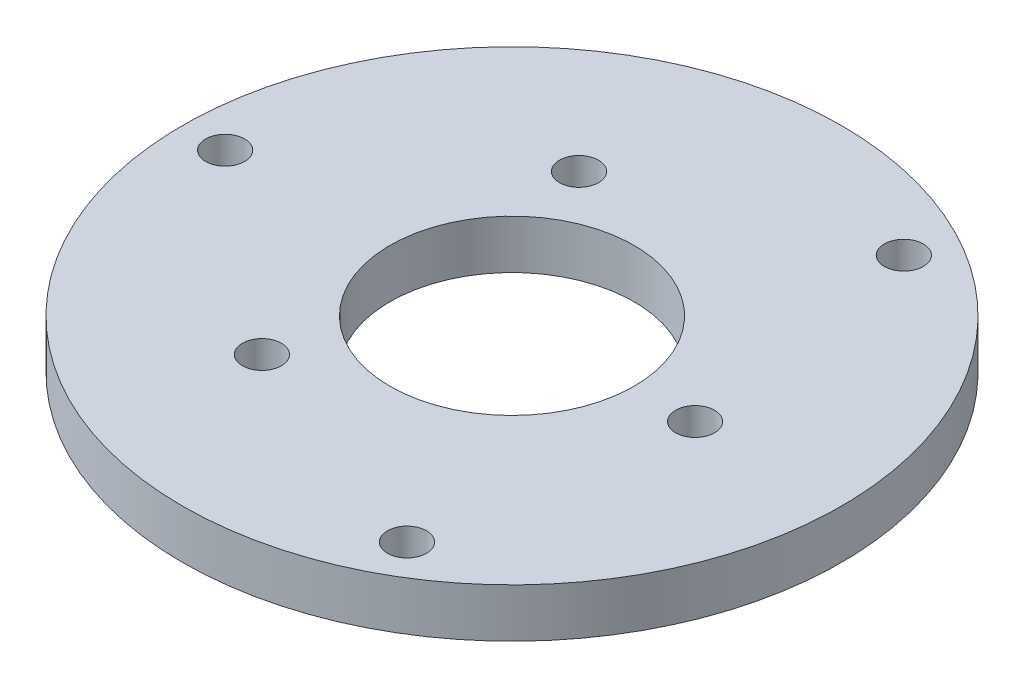
from build123d import *

# Parameters (mm, degrees)
SKETCH_1_R          = 27
SKETCH_1_R_2        = 10
SKETCH_1_R_3        = 1.6
EXTRUDE_1_DEPTH     = 4
SKETCH_3_R          = 1.6
CUT_EXTRUDE_1_DEPTH = 10


with BuildPart() as part:
    # 草图1 → 凸台-拉伸1 (new body)
    with BuildSketch(Plane(origin=(0, 0, 0), x_dir=(1, 0, 0), z_dir=(0, 1, 0))):
        with Locations(Location((0, 0, 0), (0, 0, 270))):
            Circle(SKETCH_1_R)
        with Locations(Location((0, 0, 0), (0, 0, 270))):
            Circle(SKETCH_1_R_2, mode=Mode.SUBTRACT)
        with Locations(Location((15, 0, 0), (0, 0, 270))):
            Circle(SKETCH_1_R_3, mode=Mode.SUBTRACT)
        with Locations(Location((-7.5, -12.990381057, 0), (0, 0, 270))):
            Circle(SKETCH_1_R_3, mode=Mode.SUBTRACT)
        with Locations(Location((-7.5, 12.990381057, 0), (0, 0, 270))):
            Circle(SKETCH_1_R_3, mode=Mode.SUBTRACT)
    extrude(amount=EXTRUDE_1_DEPTH)

    # 草图3 → 切除-拉伸1 (cut)
    with BuildSketch(Plane(origin=(0, 4, 0), x_dir=(1, 0, 0), z_dir=(0, 1, 0))):
        with Locations(Location((11.75, 20.351596989, 0), (0, 0, 270))):
            Circle(SKETCH_3_R)
        with Locations(Location((11.75, -20.351596989, 0), (0, 0, 270))):
            Circle(SKETCH_3_R)
        with Locations(Location((-23.5, 0, 0), (0, 0, 270))):
            Circle(SKETCH_3_R)
    extrude(amount=-CUT_EXTRUDE_1_DEPTH, mode=Mode.SUBTRACT)


solid = part.part
